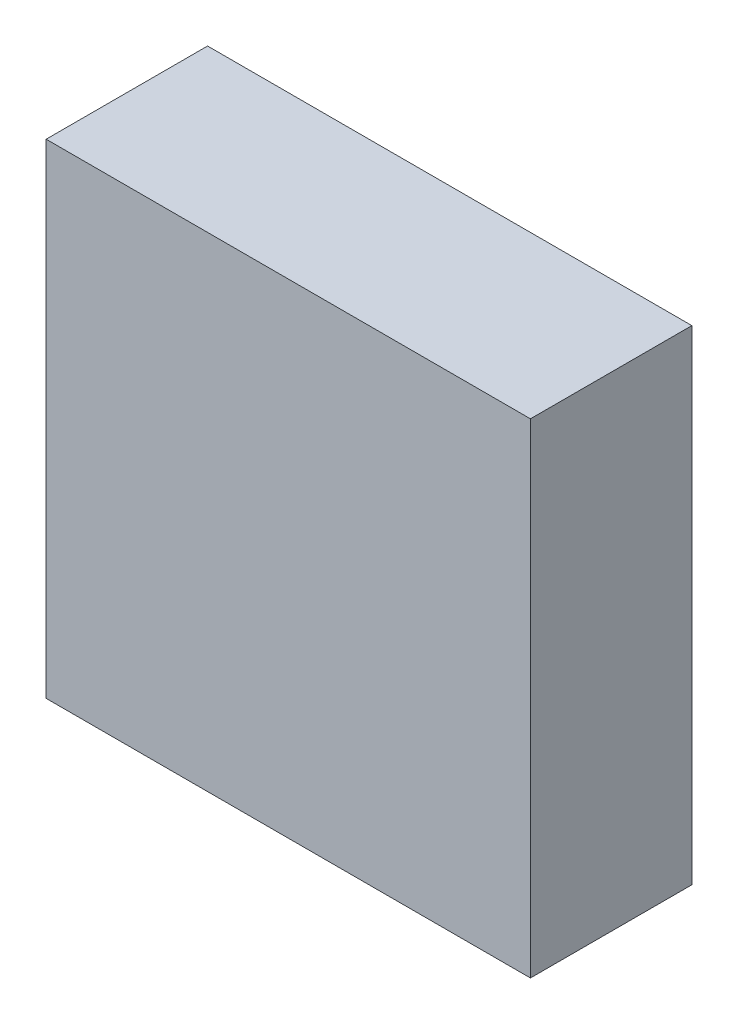
from build123d import *

# Parameters (mm, degrees)
SKETCH1_W           = 90
SKETCH1_H           = 30
SKETCH1_R           = 10.585
BOSS_EXTRUDE1_DEPTH = 80
SKETCH2_W           = 90
SKETCH2_H           = 30
BOSS_EXTRUDE2_DEPTH = 5
SKETCH3_W           = 90
SKETCH3_H           = 30
BOSS_EXTRUDE3_DEPTH = 5
SKETCH4_W           = 81.17
SKETCH4_H           = 74
CUT_EXTRUDE1_DEPTH  = 15


with BuildPart() as part:
    # Sketch1 → Boss-Extrude1 (new body)
    with BuildSketch(Plane(origin=(0, 0, 0), x_dir=(1, 0, 0), z_dir=(0, 1, 0))):
        with Locations((30, 0)):
            Rectangle(SKETCH1_W, SKETCH1_H)
        with Locations(Location((0, 0, 0), (0, 0, 270))):
            Circle(SKETCH1_R, mode=Mode.SUBTRACT)
        with Locations(Location((60, 0, 0), (0, 0, 270))):
            Circle(SKETCH1_R, mode=Mode.SUBTRACT)
        with Locations(Location((30, 0, 0), (0, 0, 270))):
            Circle(SKETCH1_R, mode=Mode.SUBTRACT)
    extrude(amount=BOSS_EXTRUDE1_DEPTH)

    # Sketch2 → Boss-Extrude2 (add)
    with BuildSketch(Plane(origin=(0, 80, 0), x_dir=(1, 0, 0), z_dir=(0, 1, 0))):
        with Locations((30, 0)):
            Rectangle(SKETCH2_W, SKETCH2_H)
    extrude(amount=BOSS_EXTRUDE2_DEPTH)

    # Sketch3 → Boss-Extrude3 (add)
    with BuildSketch(Plane.XZ):
        with Locations((30, 0)):
            Rectangle(SKETCH3_W, SKETCH3_H)
    extrude(amount=BOSS_EXTRUDE3_DEPTH)

    # Sketch4 → Cut-Extrude1 (cut)
    with BuildSketch(Plane(origin=(0, 0, -15), x_dir=(-1, 0, 0), z_dir=(0, 0, -1))):
        with Locations((-30, 40)):
            Rectangle(SKETCH4_W, SKETCH4_H)
    extrude(amount=-CUT_EXTRUDE1_DEPTH, mode=Mode.SUBTRACT)


solid = part.part
